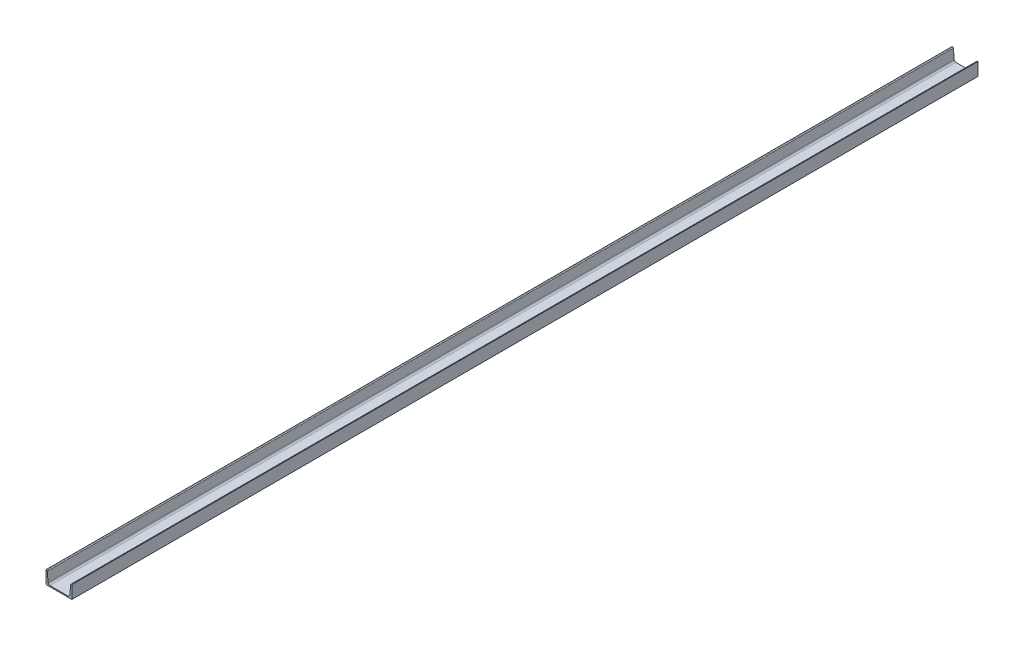
from build123d import *

# Parameters (mm, degrees)
C_CHANNEL_C_150_X_75_X_6_5_1_DEPTH = 5250


with BuildPart() as part:
    # Sketch1 → C channel C 150 X 75 X 6.5(1) (new body)
    with BuildSketch(Plane.YX):
        with BuildLine():
            Line((75, 150), (0, 150))
            Line((0, 150), (0, 0))
            Line((0, 0), (75, 0))
            Line((75, 0), (75, 2.421857404))
            ThreePointArc((75, 2.421857404), (73.686386684, 5.799808442), (70.435778714, 7.402830895))
            Line((70.435778714, 7.402830895), (15.628442573, 12.197851485))
            ThreePointArc((15.628442573, 12.197851485), (9.127226632, 15.40389639), (6.5, 22.159798466))
            Line((6.5, 22.159798466), (6.5, 127.840201534))
            ThreePointArc((6.5, 127.840201534), (9.127226632, 134.59610361), (15.628442573, 137.802148515))
            Line((15.628442573, 137.802148515), (70.435778714, 142.597169105))
            ThreePointArc((70.435778714, 142.597169105), (73.686386684, 144.200191558), (75, 147.578142596))
            Line((75, 147.578142596), (75, 150))
        make_face()
    extrude(amount=C_CHANNEL_C_150_X_75_X_6_5_1_DEPTH)


solid = part.part
